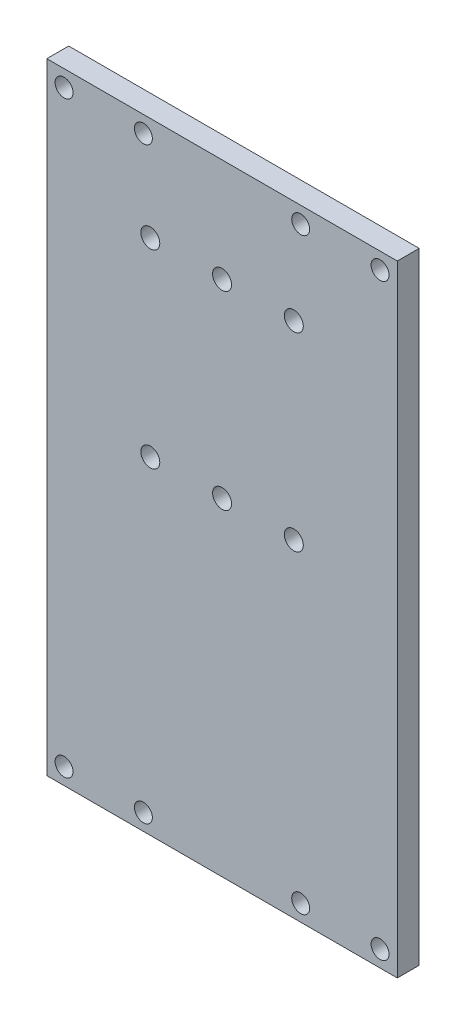
from build123d import *

# Parameters (mm, degrees)
ESBO_O1_W                = 101.6
ESBO_O1_H                = 180
RESSALTO_EXTRUS_O1_DEPTH = 6.35
CORTE_EXTRUS_O1_REACH    = 105.542
ESBO_O2_R                = 2.6
CORTE_EXTRUS_O2_REACH    = 105.542
ESBO_O3_R                = 2.75


with BuildPart() as part:
    # Esboço1 → Ressalto-extrusão1 (new body)
    with BuildSketch(Plane.XY):
        Rectangle(ESBO_O1_W, ESBO_O1_H)
    extrude(amount=RESSALTO_EXTRUS_O1_DEPTH)

    # Esboço2 → Corte-extrusão1 (cut, up to next)
    with BuildSketch(Plane.XY.offset(6.35), mode=Mode.PRIVATE) as corte_extrus_o1_sk1:
        with Locations((-45.8, 85.24)):
            Circle(ESBO_O2_R)
    corte_extrus_o1_tool1 = extrude(corte_extrus_o1_sk1.sketch, amount=-CORTE_EXTRUS_O1_REACH, mode=Mode.PRIVATE) & part.part
    # Esboço2 → Corte-extrusão1 (cut, up to next)
    with BuildSketch(Plane.XY.offset(6.35), mode=Mode.PRIVATE) as corte_extrus_o1_sk2:
        with Locations((-22.8, 85.24)):
            Circle(ESBO_O2_R)
    corte_extrus_o1_tool2 = extrude(corte_extrus_o1_sk2.sketch, amount=-CORTE_EXTRUS_O1_REACH, mode=Mode.PRIVATE) & part.part
    # Esboço2 → Corte-extrusão1 (cut, up to next)
    with BuildSketch(Plane.XY.offset(6.35), mode=Mode.PRIVATE) as corte_extrus_o1_sk3:
        with Locations((22.8, 85.24)):
            Circle(ESBO_O2_R)
    corte_extrus_o1_tool3 = extrude(corte_extrus_o1_sk3.sketch, amount=-CORTE_EXTRUS_O1_REACH, mode=Mode.PRIVATE) & part.part
    # Esboço2 → Corte-extrusão1 (cut, up to next)
    with BuildSketch(Plane.XY.offset(6.35), mode=Mode.PRIVATE) as corte_extrus_o1_sk4:
        with Locations((45.8, 85.24)):
            Circle(ESBO_O2_R)
    corte_extrus_o1_tool4 = extrude(corte_extrus_o1_sk4.sketch, amount=-CORTE_EXTRUS_O1_REACH, mode=Mode.PRIVATE) & part.part
    # Esboço2 → Corte-extrusão1 (cut, up to next)
    with BuildSketch(Plane.XY.offset(6.35), mode=Mode.PRIVATE) as corte_extrus_o1_sk5:
        with Locations((45.8, -85.24)):
            Circle(ESBO_O2_R)
    corte_extrus_o1_tool5 = extrude(corte_extrus_o1_sk5.sketch, amount=-CORTE_EXTRUS_O1_REACH, mode=Mode.PRIVATE) & part.part
    # Esboço2 → Corte-extrusão1 (cut, up to next)
    with BuildSketch(Plane.XY.offset(6.35), mode=Mode.PRIVATE) as corte_extrus_o1_sk6:
        with Locations((22.8, -85.24)):
            Circle(ESBO_O2_R)
    corte_extrus_o1_tool6 = extrude(corte_extrus_o1_sk6.sketch, amount=-CORTE_EXTRUS_O1_REACH, mode=Mode.PRIVATE) & part.part
    # Esboço2 → Corte-extrusão1 (cut, up to next)
    with BuildSketch(Plane.XY.offset(6.35), mode=Mode.PRIVATE) as corte_extrus_o1_sk7:
        with Locations((-22.8, -85.24)):
            Circle(ESBO_O2_R)
    corte_extrus_o1_tool7 = extrude(corte_extrus_o1_sk7.sketch, amount=-CORTE_EXTRUS_O1_REACH, mode=Mode.PRIVATE) & part.part
    # Esboço2 → Corte-extrusão1 (cut, up to next)
    with BuildSketch(Plane.XY.offset(6.35), mode=Mode.PRIVATE) as corte_extrus_o1_sk8:
        with Locations((-45.8, -85.24)):
            Circle(ESBO_O2_R)
    corte_extrus_o1_tool8 = extrude(corte_extrus_o1_sk8.sketch, amount=-CORTE_EXTRUS_O1_REACH, mode=Mode.PRIVATE) & part.part
    add(corte_extrus_o1_tool1.solids().sort_by_distance((-45.8, 85.24, 6.35))[0], mode=Mode.SUBTRACT)
    add(corte_extrus_o1_tool2.solids().sort_by_distance((-22.8, 85.24, 6.35))[0], mode=Mode.SUBTRACT)
    add(corte_extrus_o1_tool3.solids().sort_by_distance((22.8, 85.24, 6.35))[0], mode=Mode.SUBTRACT)
    add(corte_extrus_o1_tool4.solids().sort_by_distance((45.8, 85.24, 6.35))[0], mode=Mode.SUBTRACT)
    add(corte_extrus_o1_tool5.solids().sort_by_distance((45.8, -85.24, 6.35))[0], mode=Mode.SUBTRACT)
    add(corte_extrus_o1_tool6.solids().sort_by_distance((22.8, -85.24, 6.35))[0], mode=Mode.SUBTRACT)
    add(corte_extrus_o1_tool7.solids().sort_by_distance((-22.8, -85.24, 6.35))[0], mode=Mode.SUBTRACT)
    add(corte_extrus_o1_tool8.solids().sort_by_distance((-45.8, -85.24, 6.35))[0], mode=Mode.SUBTRACT)

    # Esboço3 → Corte-extrusão2 (cut, up to next)
    with BuildSketch(Plane.XY.offset(6.35), mode=Mode.PRIVATE) as corte_extrus_o2_sk1:
        with Locations((-20.8, 5)):
            Circle(ESBO_O3_R)
    corte_extrus_o2_tool1 = extrude(corte_extrus_o2_sk1.sketch, amount=-CORTE_EXTRUS_O2_REACH, mode=Mode.PRIVATE) & part.part
    # Esboço3 → Corte-extrusão2 (cut, up to next)
    with BuildSketch(Plane.XY.offset(6.35), mode=Mode.PRIVATE) as corte_extrus_o2_sk2:
        with Locations((0, 5)):
            Circle(ESBO_O3_R)
    corte_extrus_o2_tool2 = extrude(corte_extrus_o2_sk2.sketch, amount=-CORTE_EXTRUS_O2_REACH, mode=Mode.PRIVATE) & part.part
    # Esboço3 → Corte-extrusão2 (cut, up to next)
    with BuildSketch(Plane.XY.offset(6.35), mode=Mode.PRIVATE) as corte_extrus_o2_sk3:
        with Locations((20.8, 5)):
            Circle(ESBO_O3_R)
    corte_extrus_o2_tool3 = extrude(corte_extrus_o2_sk3.sketch, amount=-CORTE_EXTRUS_O2_REACH, mode=Mode.PRIVATE) & part.part
    # Esboço3 → Corte-extrusão2 (cut, up to next)
    with BuildSketch(Plane.XY.offset(6.35), mode=Mode.PRIVATE) as corte_extrus_o2_sk4:
        with Locations((20.8, 60)):
            Circle(ESBO_O3_R)
    corte_extrus_o2_tool4 = extrude(corte_extrus_o2_sk4.sketch, amount=-CORTE_EXTRUS_O2_REACH, mode=Mode.PRIVATE) & part.part
    # Esboço3 → Corte-extrusão2 (cut, up to next)
    with BuildSketch(Plane.XY.offset(6.35), mode=Mode.PRIVATE) as corte_extrus_o2_sk5:
        with Locations((0, 60)):
            Circle(ESBO_O3_R)
    corte_extrus_o2_tool5 = extrude(corte_extrus_o2_sk5.sketch, amount=-CORTE_EXTRUS_O2_REACH, mode=Mode.PRIVATE) & part.part
    # Esboço3 → Corte-extrusão2 (cut, up to next)
    with BuildSketch(Plane.XY.offset(6.35), mode=Mode.PRIVATE) as corte_extrus_o2_sk6:
        with Locations((-20.8, 60)):
            Circle(ESBO_O3_R)
    corte_extrus_o2_tool6 = extrude(corte_extrus_o2_sk6.sketch, amount=-CORTE_EXTRUS_O2_REACH, mode=Mode.PRIVATE) & part.part
    add(corte_extrus_o2_tool1.solids().sort_by_distance((-20.8, 5, 6.35))[0], mode=Mode.SUBTRACT)
    add(corte_extrus_o2_tool2.solids().sort_by_distance((0, 5, 6.35))[0], mode=Mode.SUBTRACT)
    add(corte_extrus_o2_tool3.solids().sort_by_distance((20.8, 5, 6.35))[0], mode=Mode.SUBTRACT)
    add(corte_extrus_o2_tool4.solids().sort_by_distance((20.8, 60, 6.35))[0], mode=Mode.SUBTRACT)
    add(corte_extrus_o2_tool5.solids().sort_by_distance((0, 60, 6.35))[0], mode=Mode.SUBTRACT)
    add(corte_extrus_o2_tool6.solids().sort_by_distance((-20.8, 60, 6.35))[0], mode=Mode.SUBTRACT)


solid = part.part
